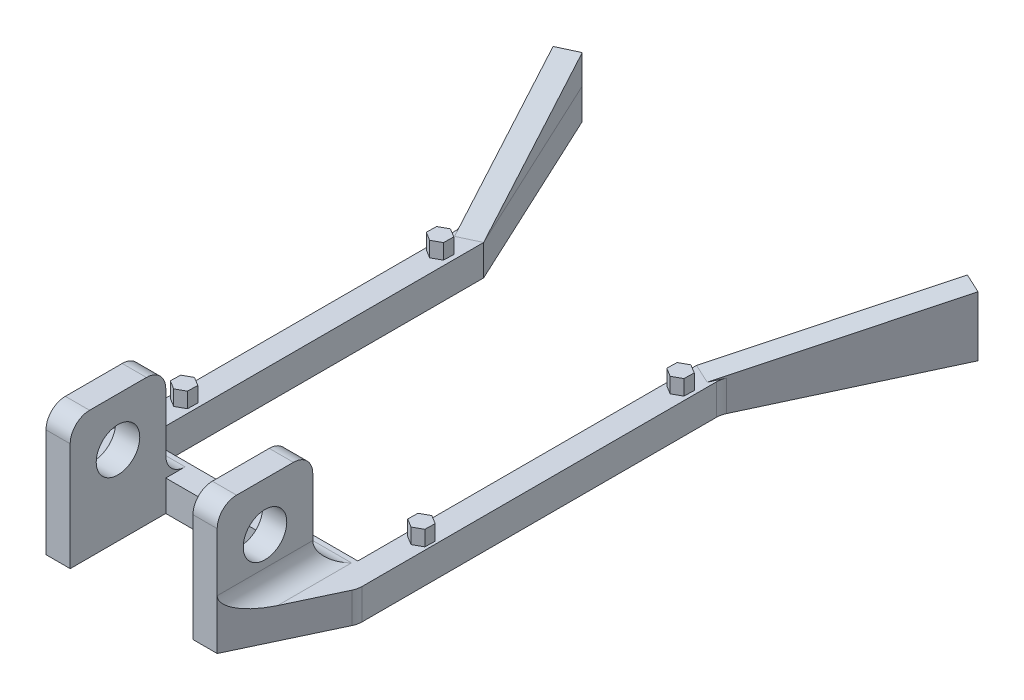
from build123d import *

# Parameters (mm, degrees)
BOSS_EXTRUDE1_DEPTH = 3.175
BOSS_EXTRUDE2_DEPTH = 2.265769468
BOSS_EXTRUDE3_DEPTH = 10
FILLET1_R           = 2
BOSS_EXTRUDE4_DEPTH = 4.75
SKETCH4_R           = 2.2500000000000018
CUT_EXTRUDE1_DEPTH  = 18.5


with BuildPart() as part:
    # Sketch1 → Boss-Extrude1 (new body)
    with BuildSketch(Plane(origin=(0, 0, 0), x_dir=(1, 0, 0), z_dir=(0, 1, 0))):
        Polygon((11, 0), (11.000000000000009, 35), (19.89888072270586, 54.08371129463171), (21.952365234814028, 53.12615574073299), (13.500000000000009, 35), (13.500000000000005, -2.5), (8.844528392438283, -12.375154125673141), (6.344528392438283, -12.375154125673143), (6.344528392438281, -2.5), (-6.344528392438281, -2.5), (-6.344528392438283, -12.375154125673143), (-8.844528392438283, -12.375154125673141), (-13.500000000000005, -2.5), (-13.500000000000009, 35), (-21.952365234814028, 53.12615574073299), (-19.89888072270586, 54.08371129463171), (-11.000000000000009, 35), (-11, 0), align=None)
        Polygon((13.099081592546982, 31.589427960182903), (13.12519792775817, 32.635931348947494), (12.231957575547105, 33.18180045307645), (11.312600888124857, 32.68116616844078), (11.286484552913668, 31.634662779676173), (12.179724905124731, 31.08879367554723), align=None, mode=Mode.SUBTRACT)
        Polygon((-11.492356645788318, 31.334168150139266), (-11.466240310577122, 32.38067153890387), (-12.359480662788181, 32.926540643032816), (-13.278837350210425, 32.425906358397164), (-13.30495368542162, 31.379402969632554), (-12.411713333210562, 30.833533865503608), align=None, mode=Mode.SUBTRACT)
        Polygon((-11.421653218284588, 4.814576152050829), (-11.395536883073392, 5.861079540815429), (-12.288777235284451, 6.406948644944381), (-13.208133922706695, 5.906314360308727), (-13.23425025791789, 4.859810971544119), (-12.341009905706835, 4.313941867415173), align=None, mode=Mode.SUBTRACT)
        Polygon((13.203019518788883, 4.715182951572258), (13.229135854000079, 5.761686340336858), (12.335895501789022, 6.307555444465811), (11.416538814366778, 5.806921159830155), (11.390422479155582, 4.760417771065549), (12.283662831366636, 4.214548666936603), align=None, mode=Mode.SUBTRACT)
    extrude(amount=BOSS_EXTRUDE1_DEPTH)


with BuildPart() as body_2:
    # Sketch2 → Boss-Extrude2 (new body)
    with BuildSketch(Plane(origin=(4.370445901306202, 0, -2.0379723933312173), x_dir=(-0.42261826174070105, 0, -0.9063077870366492), z_dir=(0.9063077870366493, 0, -0.4226182617407011))):
        Polygon((36.369573425430445, 3.175), (57.426119079782204, 6.175), (57.426119079782204, 3.175), align=None)
    boss_extrude2 = extrude(amount=-BOSS_EXTRUDE2_DEPTH)


with BuildPart() as part_1:
    add(part.part)

    # Mirror4: Boss-Extrude2 across plane
    add(boss_extrude2.mirror(Plane(origin=(0, 0, 0), x_dir=(0, 0, 1), z_dir=(1, 0, 0))))

    # Sketch3 → Boss-Extrude3 (add)
    with BuildSketch(Plane(origin=(0, 3.175, 0), x_dir=(1, 0, 0), z_dir=(0, 1, 0))):
        Polygon((8.844528392438283, -12.375154125673141), (6.344528392438281, -12.375154125673143), (6.344528392438281, -2.5), (8.844528392438283, -2.4999999999999996), align=None)
        Polygon((-8.844528392438283, -2.4999999999999996), (-6.344528392438281, -2.5), (-6.344528392438281, -12.375154125673143), (-8.844528392438283, -12.375154125673141), align=None)
    extrude(amount=BOSS_EXTRUDE3_DEPTH)

    # Fillet1
    fillet1_edges = [part_1.edges().sort_by_distance(p)[0] for p in [
        (8.844528392438283, 3.175, 7.437577062836571),
        (7.594528392438282, 3.175, 2.5),
        (7.594528392438282, 13.175, 2.5),
        (7.594528392438282, 13.175, 12.375154125673141),
        (-8.844528392438283, 3.175, 7.437577062836571),
        (-7.594528392438282, 3.175, 2.4999999999999996),
        (-7.594528392438282, 13.175, 12.375154125673143),
        (-7.594528392438282, 13.175, 2.4999999999999996),
        (13.500000000000009, 1.5875, -35),
        (13.500000000000005, 1.5875, 2.5),
        (-13.500000000000005, 1.5875, 2.5),
        (-13.500000000000009, 1.5875, -35),
    ]]
    fillet(fillet1_edges, radius=FILLET1_R)

    # Sketch1<4> → Boss-Extrude4 (add)
    with BuildSketch(Plane(origin=(0, 0, 0), x_dir=(1, 0, 0), z_dir=(0, 1, 0))):
        Polygon((-13.30495368542162, 31.379402969632554), (-12.411713333210562, 30.833533865503608), (-11.492356645788318, 31.334168150139266), (-11.466240310577122, 32.38067153890387), (-12.359480662788181, 32.926540643032816), (-13.278837350210425, 32.425906358397164), align=None)
        Polygon((11.286484552913668, 31.634662779676173), (12.179724905124731, 31.08879367554723), (13.099081592546982, 31.589427960182903), (13.12519792775817, 32.635931348947494), (12.231957575547105, 33.18180045307645), (11.312600888124857, 32.68116616844078), align=None)
        Polygon((-11.421653218284588, 4.814576152050829), (-11.395536883073392, 5.861079540815429), (-12.288777235284451, 6.406948644944381), (-13.208133922706695, 5.906314360308727), (-13.23425025791789, 4.859810971544119), (-12.341009905706835, 4.313941867415173), align=None)
        Polygon((13.203019518788883, 4.715182951572258), (13.229135854000079, 5.761686340336858), (12.335895501789022, 6.307555444465811), (11.416538814366778, 5.806921159830155), (11.390422479155582, 4.760417771065549), (12.283662831366636, 4.214548666936603), align=None)
    extrude(amount=BOSS_EXTRUDE4_DEPTH)

    # Sketch4 → Cut-Extrude1 (cut)
    with BuildSketch(Plane(origin=(8.844528392438283, 0, 0), x_dir=(0, 0, -1), z_dir=(1, 0, 0))):
        with Locations((-7.437577062836571, 8.175)):
            Circle(SKETCH4_R)
    extrude(amount=-CUT_EXTRUDE1_DEPTH, mode=Mode.SUBTRACT)


solid = Compound([body_2.part, part_1.part])
